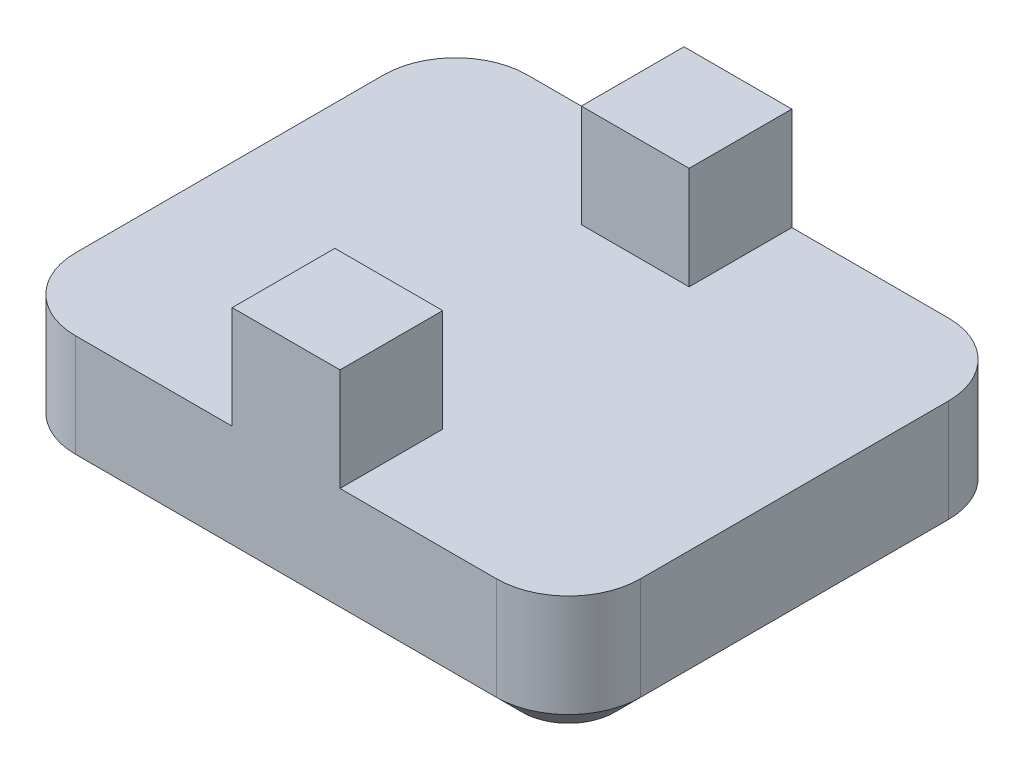
from build123d import *

# Parameters (mm, degrees)
EXTRUDE_1_DEPTH = 2.5
CHAMFER_1_SIZE  = 0.5
SKETCH_2_W      = 2.1
SKETCH_2_H      = 2
EXTRUDE_2_DEPTH = 2


with BuildPart() as part:
    # 草图1 → 凸台-拉伸1 (new body)
    with BuildSketch(Plane(origin=(0, 0, 0), x_dir=(1, 0, 0), z_dir=(0, 1, 0))):
        with BuildLine():
            Line((-53.192801429, -6.98717318), (-44.992801429, -6.98717318))
            ThreePointArc((-44.992801429, -6.98717318), (-44.002851935, -7.397223687), (-43.592801429, -8.38717318))
            Line((-43.592801429, -8.38717318), (-43.592801429, -14.38717318))
            ThreePointArc((-43.592801429, -14.38717318), (-44.002851935, -15.377122674), (-44.992801429, -15.78717318))
            Line((-44.992801429, -15.78717318), (-53.192801429, -15.78717318))
            ThreePointArc((-53.192801429, -15.78717318), (-54.182750923, -15.377122674), (-54.592801429, -14.38717318))
            Line((-54.592801429, -14.38717318), (-54.592801429, -8.38717318))
            ThreePointArc((-54.592801429, -8.38717318), (-54.182750923, -7.397223687), (-53.192801429, -6.98717318))
        make_face()
    extrude(amount=EXTRUDE_1_DEPTH)

    # 倒角1
    chamfer_1_edges = [part.edges().sort_by_distance(p)[0] for p in [
        (-49.092801429, 0, 6.98717318),
        (-44.002851935, 0, 7.397223687),
        (-43.592801429, 0, 11.38717318),
        (-44.002851935, 0, 15.377122674),
        (-49.092801429, 0, 15.78717318),
        (-54.182750923, 0, 15.377122674),
        (-54.592801429, 0, 11.38717318),
        (-54.182750923, 0, 7.397223687),
    ]]
    chamfer(chamfer_1_edges, length=CHAMFER_1_SIZE)

    # 草图2 → 凸台-拉伸2 (add)
    with BuildSketch(Plane(origin=(0, 2.5, 0), x_dir=(1, 0, 0), z_dir=(0, 1, 0))):
        with Locations((-49.092801429, -7.98717318)):
            Rectangle(SKETCH_2_W, SKETCH_2_H)
        with Locations((-49.092801429, -14.78717318)):
            Rectangle(SKETCH_2_W, SKETCH_2_H)
    extrude(amount=EXTRUDE_2_DEPTH)


solid = part.part
